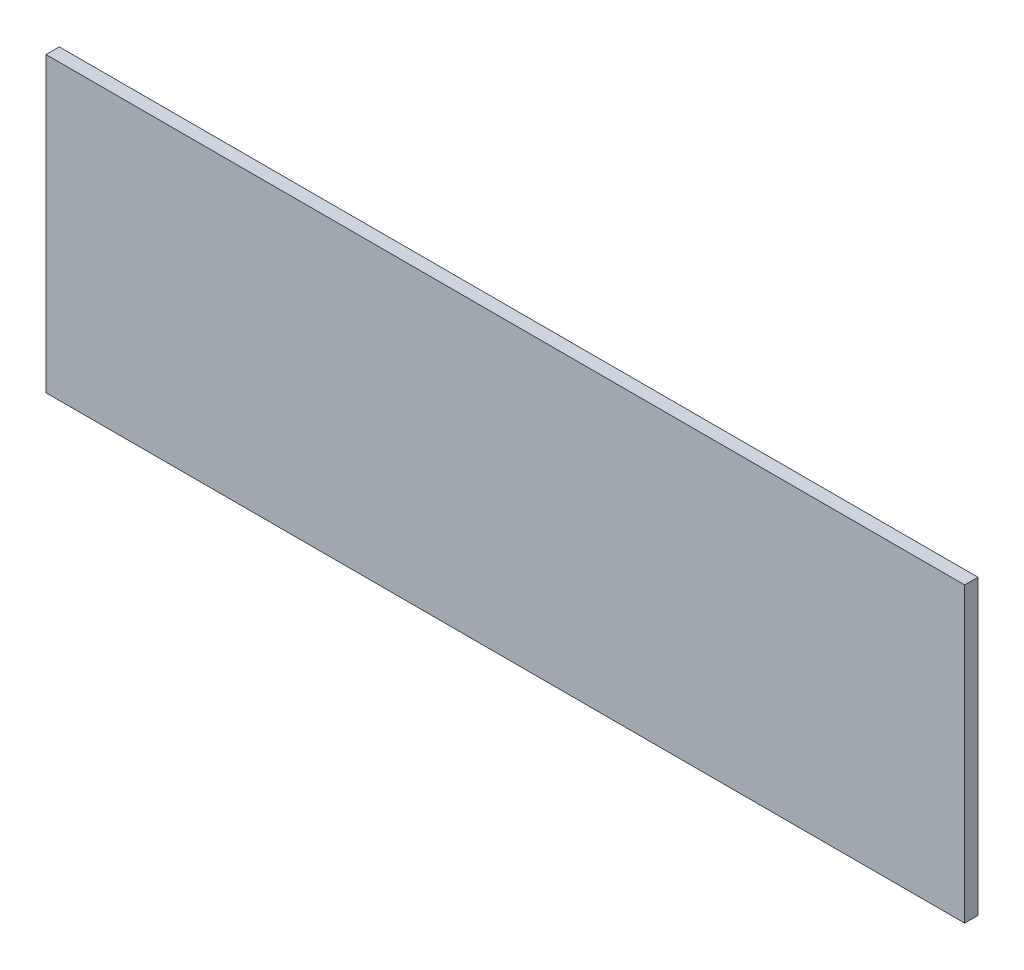
from build123d import *

# Parameters (mm, degrees)
SKETCH1_W           = 110
SKETCH1_H           = 345
BOSS_EXTRUDE1_DEPTH = 5


with BuildPart() as part:
    # Sketch1 → Boss-Extrude1 (new body)
    with BuildSketch(Plane(origin=(0, 0, 0), x_dir=(0, 1, 0), z_dir=(0, 0, 1))):
        with Locations((55, 172.5)):
            Rectangle(SKETCH1_W, SKETCH1_H)
    extrude(amount=BOSS_EXTRUDE1_DEPTH)


solid = part.part
